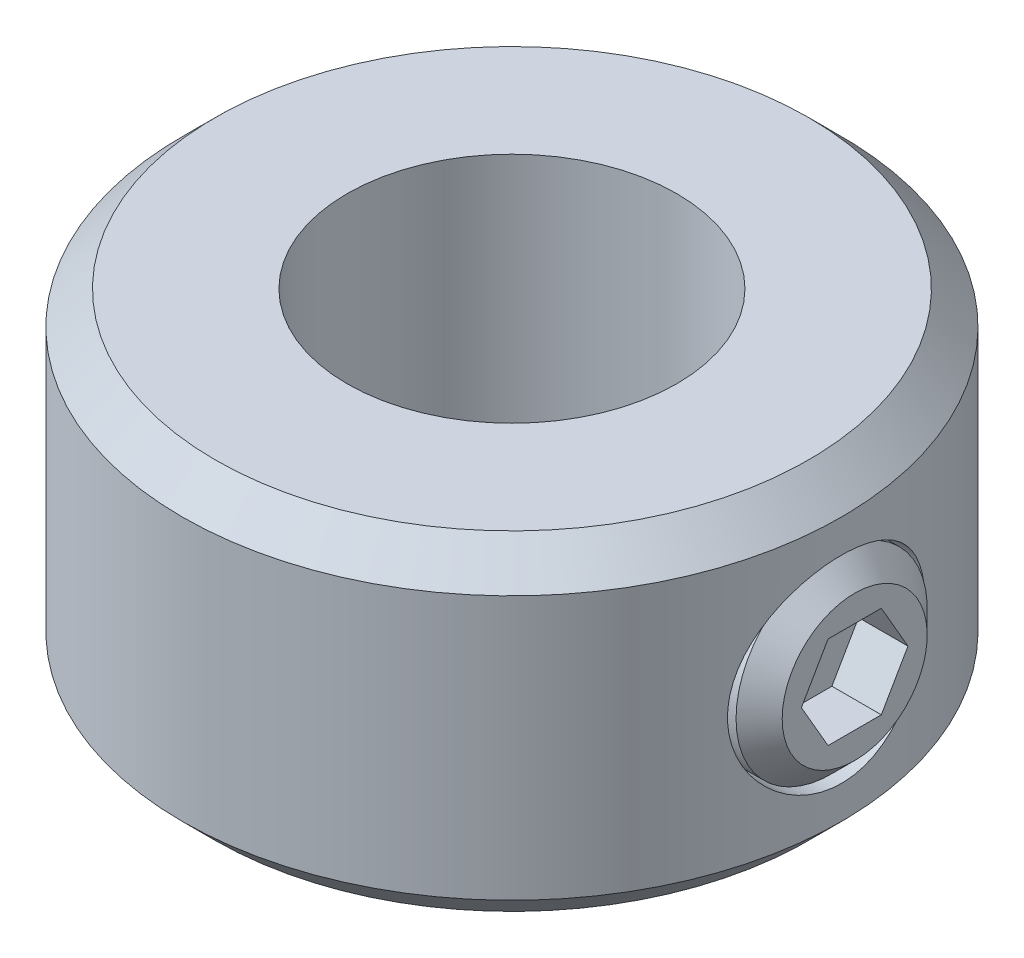
from build123d import *

# Parameters (mm, degrees)
SKETCH1_R               = 5
SKETCH1_R_2             = 2.5
BOSS_EXTRUDE1_DEPTH     = 5
CUT_EXTRUDE1_REACH      = 14.247
CUT_EXTRUDE1_END_RADIUS = 2.5
SKETCH2_R               = 1.5
CHAMFER1_SIZE           = 0.5
SKETCH3_R               = 1.45
BOSS_EXTRUDE3_DEPTH     = 2.7
CHAMFER3_SIZE           = 0.35
CUT_EXTRUDE2_DEPTH      = 0.75


with BuildPart() as part:
    # Sketch1 → Boss-Extrude1 (new body)
    with BuildSketch(Plane(origin=(0, 0, 0), x_dir=(1, 0, 0), z_dir=(0, 1, 0))):
        with Locations(Location((0, 0, 0), (0, 0, 270))):
            Circle(SKETCH1_R)
        with Locations(Location((0, 0, 0), (0, 0, 270))):
            Circle(SKETCH1_R_2, mode=Mode.SUBTRACT)
    extrude(amount=BOSS_EXTRUDE1_DEPTH)

    # Cut-Extrude1: up to this cylinder (the profile starts outside it)
    cut_extrude1_end = Plane(origin=(0, 2.5, 0), z_dir=(0, -1, 0)) * Cylinder(CUT_EXTRUDE1_END_RADIUS, 34.494, mode=Mode.PRIVATE)
    # Sketch2 → Cut-Extrude1 (cut, up to the surface)
    with BuildSketch(Plane(origin=(5, 0, 0), x_dir=(0, 0, -1), z_dir=(1, 0, 0)), mode=Mode.PRIVATE) as cut_extrude1_sk1:
        with Locations((0, 2.5)):
            Circle(SKETCH2_R)
    cut_extrude1_tool1 = extrude(cut_extrude1_sk1.sketch, amount=-CUT_EXTRUDE1_REACH, mode=Mode.PRIVATE) - cut_extrude1_end
    add(cut_extrude1_tool1.solids().sort_by_distance((5, 2.5, 0))[0], mode=Mode.SUBTRACT)

    # Chamfer1
    chamfer1_edges = [part.edges().sort_by_distance(p)[0] for p in [
        (0, 0, -5),
        (0, 5, -5),
    ]]
    chamfer(chamfer1_edges, length=CHAMFER1_SIZE)


with BuildPart() as body_2:
    # Sketch3 → Boss-Extrude3 (new body)
    with BuildSketch(Plane.ZY.offset(-2.5)):
        with Locations((0, 2.5)):
            Circle(SKETCH3_R)
    extrude(amount=-BOSS_EXTRUDE3_DEPTH)

    # Chamfer3
    chamfer3_edges = [body_2.edges().sort_by_distance(p)[0] for p in [
        (5.2, 2.5, -1.45),
    ]]
    chamfer(chamfer3_edges, length=CHAMFER3_SIZE)

    # Sketch4 → Cut-Extrude2 (cut)
    with BuildSketch(Plane(origin=(5.2, 0, 0), x_dir=(0, 0, -1), z_dir=(1, 0, 0))):
        Polygon((0.808290377, 2.5), (0.404145188, 3.2), (-0.404145188, 3.2), (-0.808290377, 2.5), (-0.404145188, 1.8), (0.404145188, 1.8), align=None)
    extrude(amount=-CUT_EXTRUDE2_DEPTH, mode=Mode.SUBTRACT)


solid = Compound([part.part, body_2.part])
